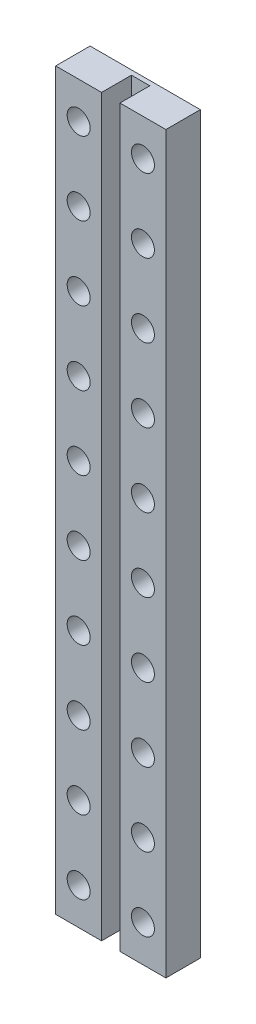
from build123d import *

# Parameters (mm, degrees)
BASE_DEPTH  = 160
ESQUISSE2_R = 2.5
TROU_DEPTH  = 161.624562256


with BuildPart() as part:
    # Esquisse1 → BASE (new body)
    with BuildSketch(Plane(origin=(0, 0, 0), x_dir=(1, 0, 0), z_dir=(0, 1, 0))):
        Polygon((-2, -3.75), (-2, 2.75), (2, 2.75), (2, -3.75), (12, -3.75), (12, 3.75), (-12, 3.75), (-12, -3.75), align=None)
    extrude(amount=-BASE_DEPTH)

    # Esquisse2 → TROU (cut, through all)
    with BuildSketch(Plane.XY.offset(3.75)):
        with Locations((-7, -8)):
            Circle(ESQUISSE2_R)
        with Locations((7, -8)):
            Circle(ESQUISSE2_R)
        with Locations((7, -24)):
            Circle(ESQUISSE2_R)
        with Locations((7, -40)):
            Circle(ESQUISSE2_R)
        with Locations((7, -56)):
            Circle(ESQUISSE2_R)
        with Locations((7, -72)):
            Circle(ESQUISSE2_R)
        with Locations((7, -88)):
            Circle(ESQUISSE2_R)
        with Locations((7, -104)):
            Circle(ESQUISSE2_R)
        with Locations((7, -120)):
            Circle(ESQUISSE2_R)
        with Locations((7, -136)):
            Circle(ESQUISSE2_R)
        with Locations((7, -152)):
            Circle(ESQUISSE2_R)
        with Locations((-7, -24)):
            Circle(ESQUISSE2_R)
        with Locations((-7, -40)):
            Circle(ESQUISSE2_R)
        with Locations((-7, -56)):
            Circle(ESQUISSE2_R)
        with Locations((-7, -72)):
            Circle(ESQUISSE2_R)
        with Locations((-7, -88)):
            Circle(ESQUISSE2_R)
        with Locations((-7, -104)):
            Circle(ESQUISSE2_R)
        with Locations((-7, -120)):
            Circle(ESQUISSE2_R)
        with Locations((-7, -136)):
            Circle(ESQUISSE2_R)
        with Locations((-7, -152)):
            Circle(ESQUISSE2_R)
    extrude(amount=-TROU_DEPTH, mode=Mode.SUBTRACT)


solid = part.part
